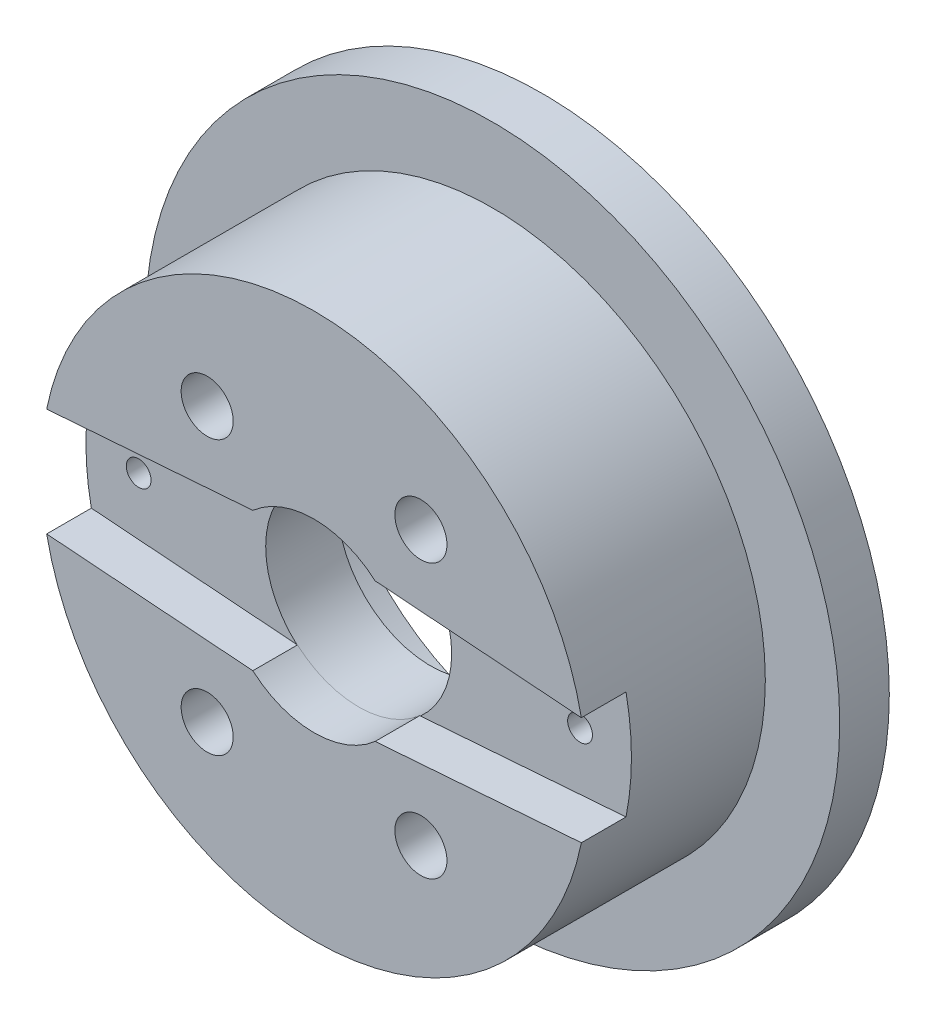
from build123d import *

# Parameters (mm, degrees)
BOSS_EXTRU_1_START      = 1.8
ESQUISSE2_R             = 0.5
BOSS_EXTRU_1_DEPTH      = 1.8
ESQUISSE4_R             = 0.5
ENL_V_MAT_EXTRU_3_DEPTH = 22.832086478
ESQUISSE6_R             = 2.1
ENL_V_MAT_EXTRU_4_DEPTH = 2
ESQUISSE7_R             = 1.05
ENL_V_MAT_EXTRU_5_DEPTH = 21.349201459


with BuildPart() as part:
    # Esquisse1 → Révolution1 (revolve)
    with BuildSketch(Plane(origin=(0, 0, 0), x_dir=(1, 0, 0), z_dir=(0, 1, 0))):
        Polygon((-11, 0), (-3.75, 0), (-3.75, 2.9), (-9, 2.9), (-9, 7.4), (-14, 7.4), (-14, 5.4), (-11, 5.4), align=None)
    revolve(axis=Axis((0, 0, 0), (0, 0, -1)))

    # Esquisse2 → Boss.-Extru.1 (add)
    with BuildSketch(Plane.XY.offset(BOSS_EXTRU_1_START)):
        with Locations((-8.872610569, 0)):
            Circle(ESQUISSE2_R)
        with Locations((8.927389431, 0)):
            Circle(ESQUISSE2_R)
        with BuildLine():
            Line((-2.468322158, 2.8), (-10.781965021, 2.179272878))
            ThreePointArc((-10.781965021, 2.179272878), (-0.002117582, 10.999999796), (10.78112517, 2.183423933))
            Line((10.78112517, 2.183423933), (2.463250179, 2.804463021))
            ThreePointArc((2.463250179, 2.804463021), (-0.003378, 3.732640201), (-2.468322158, 2.8))
        make_face()
        with BuildLine():
            Line((-10.781965021, -2.179272878), (-2.468322158, -2.8))
            ThreePointArc((-2.468322158, -2.8), (-0.003378, -3.732640201), (2.463250179, -2.804463021))
            Line((2.463250179, -2.804463021), (10.78112517, -2.183423933))
            ThreePointArc((10.78112517, -2.183423933), (-0.002117582, -10.999999796), (-10.781965021, -2.179272878))
        make_face()
    extrude(amount=-BOSS_EXTRU_1_DEPTH)

    # Esquisse4 → Enlèv. mat.-Extru.3 (cut, through all)
    with BuildSketch(Plane.XY.offset(1.8)):
        with Locations((-8.872610569, 0)):
            Circle(ESQUISSE4_R)
        with Locations((8.927389431, 0)):
            Circle(ESQUISSE4_R)
    extrude(amount=-ENL_V_MAT_EXTRU_3_DEPTH, mode=Mode.SUBTRACT)

    # Esquisse6 → Enlèv. mat.-Extru.4 (cut)
    with BuildSketch(Plane(origin=(0, 0, -2.9), x_dir=(-1, 0, 0), z_dir=(0, 0, -1))):
        with Locations((-4.309630327, 5.516075275)):
            Circle(ESQUISSE6_R)
        with Locations((4.309630327, 5.516075275)):
            Circle(ESQUISSE6_R)
        with Locations((-4.309630327, -5.516075275)):
            Circle(ESQUISSE6_R)
        with Locations((4.309630327, -5.516075275)):
            Circle(ESQUISSE6_R)
    extrude(amount=-ENL_V_MAT_EXTRU_4_DEPTH, mode=Mode.SUBTRACT)

    # Esquisse7 → Enlèv. mat.-Extru.5 (cut, through all)
    with BuildSketch(Plane(origin=(0, 0, -2.9), x_dir=(-1, 0, 0), z_dir=(0, 0, -1))):
        with Locations((4.309630327, -5.516075275)):
            Circle(ESQUISSE7_R)
        with Locations((-4.309630327, -5.516075275)):
            Circle(ESQUISSE7_R)
        with Locations((4.309630327, 5.516075275)):
            Circle(ESQUISSE7_R)
        with Locations((-4.309630327, 5.516075275)):
            Circle(ESQUISSE7_R)
    extrude(amount=-ENL_V_MAT_EXTRU_5_DEPTH, mode=Mode.SUBTRACT)


solid = part.part
